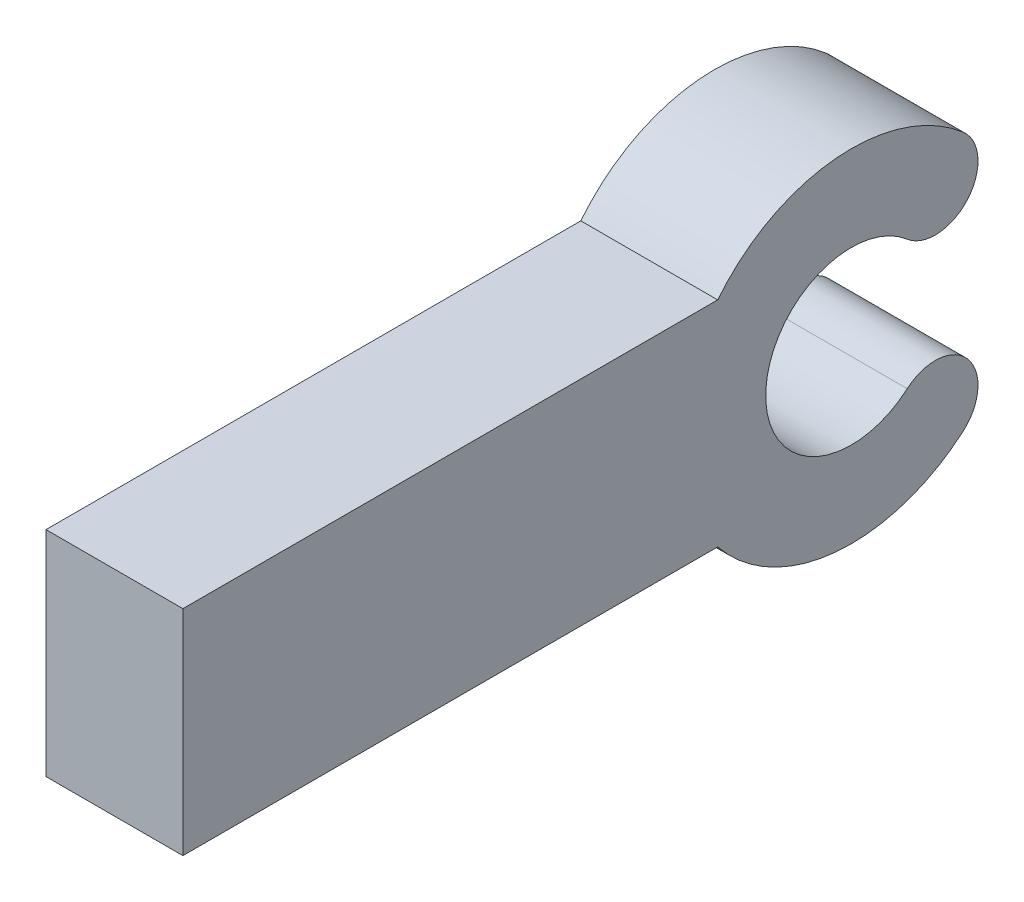
from build123d import *

# Parameters (mm, degrees)
BOSS_EXTRUDE1_DEPTH = 1.6256


with BuildPart() as part:
    # Sketch1 → Boss-Extrude1 (new body)
    with BuildSketch(Plane(origin=(0, 0, 0), x_dir=(0, 0, -1), z_dir=(1, 0, 0))):
        with BuildLine():
            Line((0, 0), (6.35, 0))
            ThreePointArc((6.35, 0), (7.750762825, -0.753518252), (9.265164366, -0.267190977))
            ThreePointArc((9.265164366, -0.267190977), (9.317228392, 0.449340486), (8.600696929, 0.501404512))
            ThreePointArc((8.600696929, 0.501404512), (6.920229492, 1.27), (8.600696929, 2.038595488))
            ThreePointArc((8.600696929, 2.038595488), (9.317228392, 2.090659514), (9.265164366, 2.807190977))
            ThreePointArc((9.265164366, 2.807190977), (7.750762825, 3.293518252), (6.35, 2.54))
            Line((6.35, 2.54), (0, 2.54))
            Line((0, 2.54), (0, 0))
        make_face()
    extrude(amount=BOSS_EXTRUDE1_DEPTH)


solid = part.part
